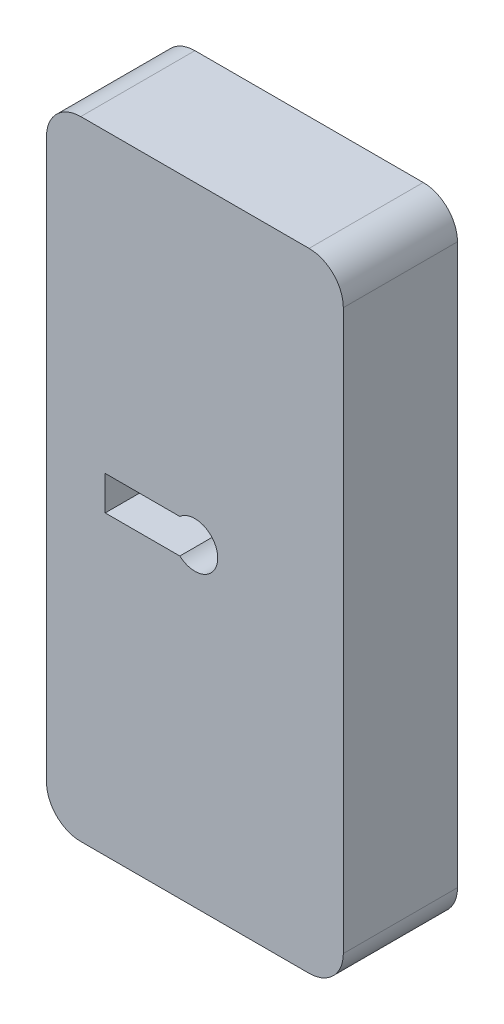
from build123d import *

# Parameters (mm, degrees)
BOSS_EXTRUDE1_DEPTH = 10
SKETCH5_R           = 4
CUT_EXTRUDE3_DEPTH  = 5
CUT_EXTRUDE1_REACH  = 52.252
SKETCH3_R           = 1.65
CUT_EXTRUDE2_DEPTH  = 3.3
FILLET1_R           = 1.65


with BuildPart() as part:
    # Sketch1 → Boss-Extrude1 (new body)
    with BuildSketch(Plane.XY):
        with BuildLine():
            Line((-10, -47.5), (10, -47.5))
            ThreePointArc((10, -47.5), (12.121320344, -46.621320344), (13, -44.5))
            Line((13, -44.5), (13, 4.5))
            ThreePointArc((13, 4.5), (12.121320344, 6.621320344), (10, 7.5))
            Line((10, 7.5), (-10, 7.5))
            ThreePointArc((-10, 7.5), (-12.121320344, 6.621320344), (-13, 4.5))
            Line((-13, 4.5), (-13, -44.5))
            ThreePointArc((-13, -44.5), (-12.121320344, -46.621320344), (-10, -47.5))
        make_face()
    extrude(amount=BOSS_EXTRUDE1_DEPTH)

    # Sketch5 → Cut-Extrude3 (cut)
    with BuildSketch(Plane(origin=(0, 0, 0), x_dir=(-1, 0, 0), z_dir=(0, 0, -1))):
        with Locations((0, -20)):
            Circle(SKETCH5_R)
    extrude(amount=-CUT_EXTRUDE3_DEPTH, mode=Mode.SUBTRACT)

    # Cut-Extrude1: up to this face of the body (flat: up to its plane)
    cut_extrude1_end = Plane(part.part.faces().sort_by_distance((-11.69114596, -46.19114596, 0))[0])
    # Sketch2 → Cut-Extrude1 (cut, up to the picked face)
    with BuildSketch(Plane.XY.offset(10), mode=Mode.PRIVATE) as cut_extrude1_sk1:
        with BuildLine():
            Line((-1.322875656, -18.5), (-7.858116823, -18.5))
            Line((-7.858116823, -18.5), (-7.858116823, -21.5))
            Line((-7.858116823, -21.5), (-1.322875656, -21.5))
            ThreePointArc((-1.322875656, -21.5), (2, -20), (-1.322875656, -18.5))
        make_face()
    cut_extrude1_tool1 = split(extrude(cut_extrude1_sk1.sketch, amount=-CUT_EXTRUDE1_REACH, mode=Mode.PRIVATE), bisect_by=cut_extrude1_end, keep=Keep.BOTH, mode=Mode.PRIVATE)
    add(cut_extrude1_tool1.solids().sort_by(Axis((-2.852345, -20, 10), (0, 0, -1)))[0], mode=Mode.SUBTRACT)

    # Sketch3 → Cut-Extrude2 (cut)
    with BuildSketch(Plane(origin=(0, 0, 0), x_dir=(-1, 0, 0), z_dir=(0, 0, -1))):
        with Locations((0, -5.5)):
            Circle(SKETCH3_R)
        with Locations((0, -9)):
            Circle(SKETCH3_R)
        with Locations((0, -12.5)):
            Circle(SKETCH3_R)
    extrude(amount=-CUT_EXTRUDE2_DEPTH, mode=Mode.SUBTRACT)

    # Fillet1
    fillet1_edges = [part.edges().sort_by_distance(p)[0] for p in [
        (1.65, -5.5, 3.3),
        (1.65, -9, 3.3),
        (1.65, -12.5, 3.3),
    ]]
    fillet(fillet1_edges, radius=FILLET1_R)


solid = part.part
